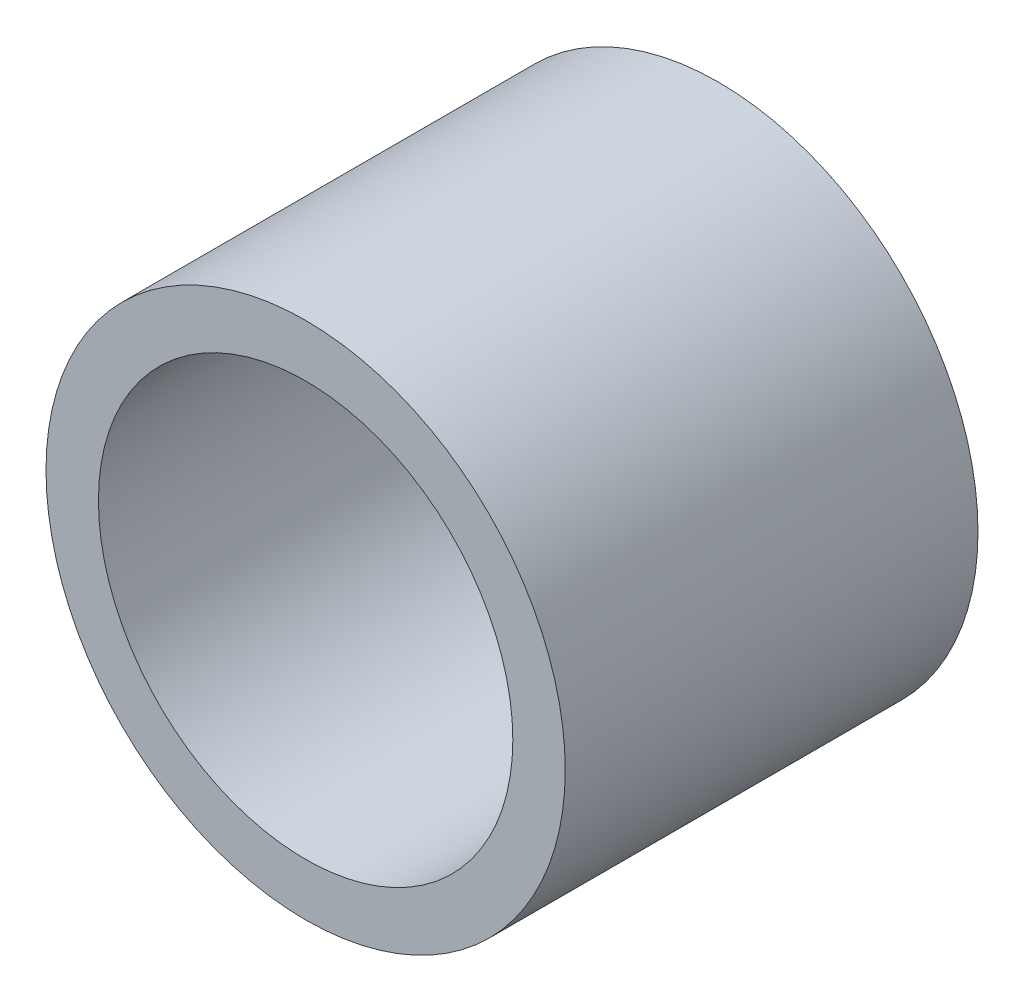
from build123d import *

# Parameters (mm, degrees)
BOSS_EXTRUDE1_DEPTH      = 3.175
BOSS_EXTRUDE1_DEPTH_BACK = 3.175
SKETCH5_R                = 3.99415
SKETCH5_R_2              = 3.1877


with BuildPart() as part:
    # Sketch5 → Boss-Extrude1 (new, two sides: drawn at the far end of the back side and taken through both)
    with BuildSketch(Plane.XY.offset(-BOSS_EXTRUDE1_DEPTH_BACK)):
        Circle(SKETCH5_R)
        Circle(SKETCH5_R_2, mode=Mode.SUBTRACT)
    extrude(amount=BOSS_EXTRUDE1_DEPTH + BOSS_EXTRUDE1_DEPTH_BACK)


solid = part.part
